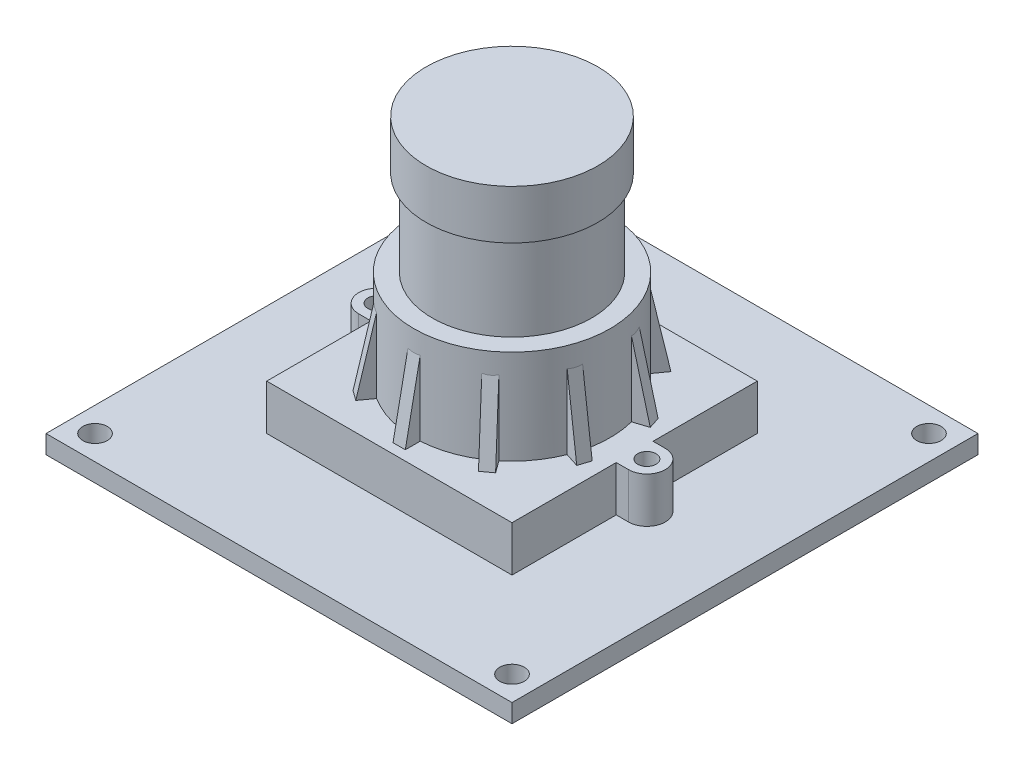
from build123d import *

# Parameters (mm, degrees)
SKETCH_1_W          = 38
SKETCH_1_H          = 38
SKETCH_1_R          = 1
EXTRUDE_1_DEPTH     = 1.5
SKETCH_2_R          = 0.75
EXTRUDE_2_DEPTH     = 3.7
SKETCH1_R           = 8
BOSS_EXTRUDE1_DEPTH = 7.7
RIB1_REACH          = 31.806
SKETCH4_WALL_W      = 67.73123823
SKETCH4_WALL_H      = 1
CIRPATTERN1_COUNT   = 10


with BuildPart() as part:
    # 草图1 → 凸台-拉伸1 (new body)
    with BuildSketch(Plane(origin=(0, 0, 0), x_dir=(1, 0, 0), z_dir=(0, 1, 0))):
        Rectangle(SKETCH_1_W, SKETCH_1_H)
        with Locations(Location((-17, 17, 0), (0, 0, 270))):
            Circle(SKETCH_1_R, mode=Mode.SUBTRACT)
        with Locations(Location((17, 17, 0), (0, 0, 90))):
            Circle(SKETCH_1_R, mode=Mode.SUBTRACT)
        with Locations(Location((17, -17, 0), (0, 0, 270))):
            Circle(SKETCH_1_R, mode=Mode.SUBTRACT)
        with Locations(Location((-17, -17, 0), (0, 0, 90))):
            Circle(SKETCH_1_R, mode=Mode.SUBTRACT)
    extrude(amount=EXTRUDE_1_DEPTH)

    # 草图2 → 凸台-拉伸2 (add)
    with BuildSketch(Plane(origin=(0, 1.5, 0), x_dir=(1, 0, 0), z_dir=(0, 1, 0))):
        with BuildLine():
            Line((-10, -10), (10, -10))
            Line((10, -10), (10, -1.5))
            Line((10, -1.5), (11, -1.5))
            ThreePointArc((11, -1.5), (12.5, 0), (11, 1.5))
            Line((11, 1.5), (10, 1.5))
            Line((10, 1.5), (10, 10))
            Line((10, 10), (-10, 10))
            Line((-10, 10), (-10, 1.5))
            Line((-10, 1.5), (-11, 1.5))
            ThreePointArc((-11, 1.5), (-12.5, 0), (-11, -1.5))
            Line((-11, -1.5), (-10, -1.5))
            Line((-10, -1.5), (-10, -10))
        make_face()
        with Locations(Location((11, 0, 0), (0, 0, 270))):
            Circle(SKETCH_2_R, mode=Mode.SUBTRACT)
        with Locations(Location((-11, 0, 0), (0, 0, 90))):
            Circle(SKETCH_2_R, mode=Mode.SUBTRACT)
    extrude(amount=EXTRUDE_2_DEPTH)

    # Sketch1 → Boss-Extrude1 (add)
    with BuildSketch(Plane(origin=(0, 5.2, 0), x_dir=(1, 0, 0), z_dir=(0, 1, 0))):
        with Locations(Location((0, 0, 0), (0, 0, 90))):
            Circle(SKETCH1_R)
    extrude(amount=BOSS_EXTRUDE1_DEPTH)

    # Sketch4 wall → Rib1 (add, up to next)
    with BuildSketch(Plane(origin=(0, 8.2, -8.6), x_dir=(0, -0.980580675691, -0.196116135138), z_dir=(0, 0.196116135138, -0.980580675691)), mode=Mode.PRIVATE) as rib1_sk1:
        Rectangle(SKETCH4_WALL_W, SKETCH4_WALL_H)
    rib1_tool1 = extrude(rib1_sk1.sketch, amount=-RIB1_REACH, mode=Mode.PRIVATE) - part.part
    rib1 = rib1_tool1.solids().sort_by_distance((0, 8.2, -8.6))[0]
    add(rib1)

    # CirPattern1: Rib1 ×10 about axis
    cirpattern1_axis = Axis((0, 0, 0), (0, 1, 0))
    for i in range(1, CIRPATTERN1_COUNT):
        add(rib1.rotate(cirpattern1_axis, i * 360 / CIRPATTERN1_COUNT))

    # Sketch5 → Revolve1 (revolve)
    with BuildSketch(Plane(origin=(0, 0, 0), x_dir=(0, 0, -1), z_dir=(1, 0, 0))):
        Polygon((0, 23.9), (7, 23.9), (7, 19.9), (6.5, 19.9), (6.5, 12.9), (0, 12.9), align=None)
    revolve(axis=Axis((0, 12.9, 0), (0, 1, 0)))


solid = part.part
